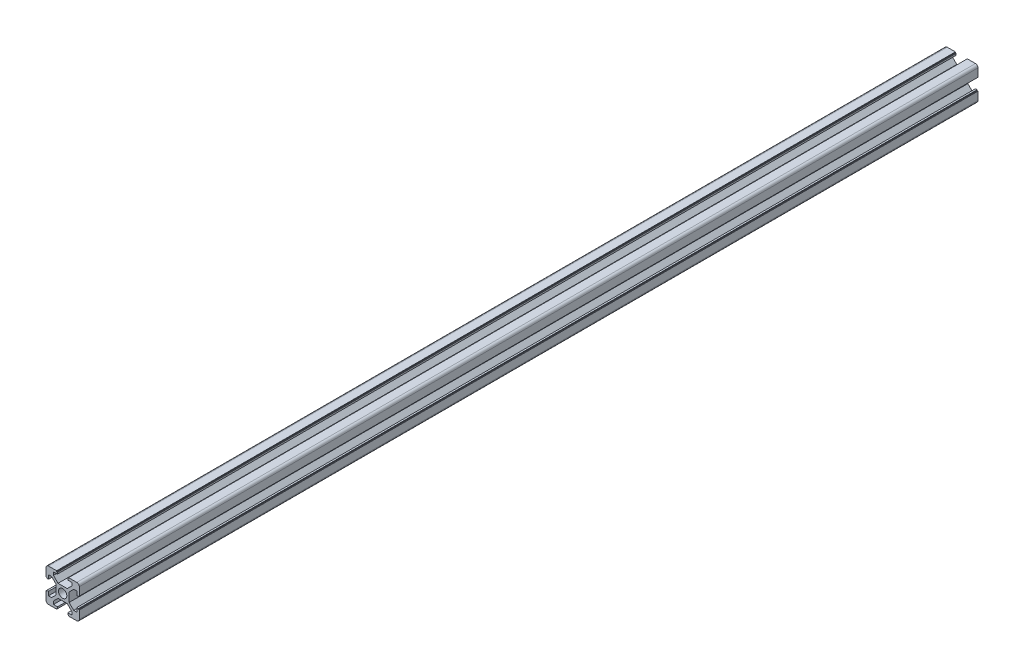
from build123d import *

# Parameters (mm, degrees)
SKETCH13_R               = 2.5
F_20_X_20_X_R1_5_1_DEPTH = 540


with BuildPart() as part:
    # Sketch13 → 铝型材 20 X 20 X R1.5(1) (new body)
    with BuildSketch(Plane.YX):
        with BuildLine():
            Line((-3.6, 10), (-3.6, 9.5))
            Line((-3.6, 9.5), (-3.1, 9.5))
            Line((-3.1, 9.5), (-3.1, 8.5))
            Line((-3.1, 8.5), (-5.5, 8.5))
            Line((-5.5, 8.5), (-5.5, 6.65))
            Line((-5.5, 6.65), (-2.75, 3.9))
            Line((-2.75, 3.9), (2.75, 3.9))
            Line((2.75, 3.9), (5.5, 6.65))
            Line((5.5, 6.65), (5.5, 8.5))
            Line((5.5, 8.5), (3.1, 8.5))
            Line((3.1, 8.5), (3.1, 9.5))
            Line((3.1, 9.5), (3.6, 9.5))
            Line((3.6, 9.5), (3.6, 10))
            Line((3.6, 10), (8.5, 10))
            ThreePointArc((8.5, 10), (9.560660172, 9.560660172), (10, 8.5))
            Line((10, 8.5), (10, 3.6))
            Line((10, 3.6), (9.5, 3.6))
            Line((9.5, 3.6), (9.5, 3.1))
            Line((9.5, 3.1), (8.5, 3.1))
            Line((8.5, 3.1), (8.5, 5.5))
            Line((8.5, 5.5), (6.65, 5.5))
            Line((6.65, 5.5), (3.9, 2.75))
            Line((3.9, 2.75), (3.9, -2.75))
            Line((3.9, -2.75), (6.65, -5.5))
            Line((6.65, -5.5), (8.5, -5.5))
            Line((8.5, -5.5), (8.5, -3.1))
            Line((8.5, -3.1), (9.5, -3.1))
            Line((9.5, -3.1), (9.5, -3.6))
            Line((9.5, -3.6), (10, -3.6))
            Line((10, -3.6), (10, -8.5))
            ThreePointArc((10, -8.5), (9.560660172, -9.560660172), (8.5, -10))
            Line((8.5, -10), (3.6, -10))
            Line((3.6, -10), (3.6, -9.5))
            Line((3.6, -9.5), (3.1, -9.5))
            Line((3.1, -9.5), (3.1, -8.5))
            Line((3.1, -8.5), (5.5, -8.5))
            Line((5.5, -8.5), (5.5, -6.65))
            Line((5.5, -6.65), (2.75, -3.9))
            Line((2.75, -3.9), (-2.75, -3.9))
            Line((-2.75, -3.9), (-5.5, -6.65))
            Line((-5.5, -6.65), (-5.5, -8.5))
            Line((-5.5, -8.5), (-3.1, -8.5))
            Line((-3.1, -8.5), (-3.1, -9.5))
            Line((-3.1, -9.5), (-3.6, -9.5))
            Line((-3.6, -9.5), (-3.6, -10))
            Line((-3.6, -10), (-8.5, -10))
            ThreePointArc((-8.5, -10), (-9.560660172, -9.560660172), (-10, -8.5))
            Line((-10, -8.5), (-10, -3.6))
            Line((-10, -3.6), (-9.5, -3.6))
            Line((-9.5, -3.6), (-9.5, -3.1))
            Line((-9.5, -3.1), (-8.5, -3.1))
            Line((-8.5, -3.1), (-8.5, -5.5))
            Line((-8.5, -5.5), (-6.65, -5.5))
            Line((-6.65, -5.5), (-3.9, -2.75))
            Line((-3.9, -2.75), (-3.9, 2.75))
            Line((-3.9, 2.75), (-6.65, 5.5))
            Line((-6.65, 5.5), (-8.5, 5.5))
            Line((-8.5, 5.5), (-8.5, 3.1))
            Line((-8.5, 3.1), (-9.5, 3.1))
            Line((-9.5, 3.1), (-9.5, 3.6))
            Line((-9.5, 3.6), (-10, 3.6))
            Line((-10, 3.6), (-10, 8.5))
            ThreePointArc((-10, 8.5), (-9.560660172, 9.560660172), (-8.5, 10))
            Line((-8.5, 10), (-3.6, 10))
        make_face()
        Circle(SKETCH13_R, mode=Mode.SUBTRACT)
    extrude(amount=F_20_X_20_X_R1_5_1_DEPTH)


solid = part.part
